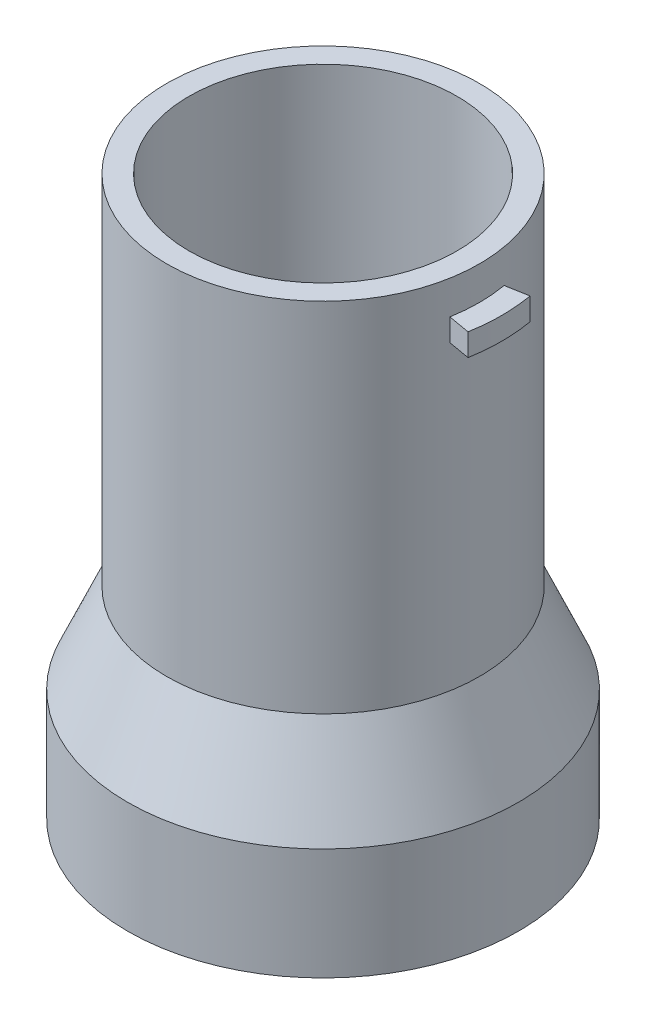
from build123d import *

# Parameters (mm, degrees)
SKETCH2_W          = 2
SKETCH2_H          = 2
REVOLVE2_ANGLE     = 20
SKETCH3_W          = 2.2
SKETCH3_H          = 6.8
CUT_REVOLVE1_ANGLE = 25
SKETCH4_W          = 4.7
SKETCH4_H          = 2.5
CUT_REVOLVE2_ANGLE = 45


with BuildPart() as part:
    # Sketch1 → Revolve1 (revolve)
    with BuildSketch(Plane.XY, mode=Mode.PRIVATE) as revolve1_sk:
        Polygon((12, 25), (12, -15), (14.5, -15), (14.5, -25), (17.5, -25), (17.5, -15), (14, -7), (14, 25), align=None)
    revolve(revolve1_sk.sketch.rotate(Axis((0, 40.467735012, 0), (0, -1, 0)), 90), axis=Axis((0, 40.467735012, 0), (0, -1, 0)))

    # Sketch2 → Revolve2 (revolve, symmetric)
    with BuildSketch(Plane.XY) as revolve2_sk:
        with Locations((15, 21)):
            Rectangle(SKETCH2_W, SKETCH2_H)
        with Locations((-15, 21)):
            Rectangle(SKETCH2_W, SKETCH2_H)
    revolve(axis=Axis((0, 45.306661743, 0), (0, -1, 0)), revolution_arc=REVOLVE2_ANGLE / 2)
    revolve(revolve2_sk.sketch, axis=Axis((0, 45.306661743, 0), (0, 1, 0)), revolution_arc=REVOLVE2_ANGLE / 2)

    # Sketch3 → Cut-Revolve1 (revolve, symmetric, cut)
    with BuildSketch(Plane.XY) as cut_revolve1_sk:
        with Locations((-15.6, -21.6)):
            Rectangle(SKETCH3_W, SKETCH3_H)
        with Locations((15.6, -21.6)):
            Rectangle(SKETCH3_W, SKETCH3_H)
    revolve(axis=Axis((0, -11.020729768, 0), (0, -1, 0)), revolution_arc=CUT_REVOLVE1_ANGLE / 2, mode=Mode.SUBTRACT)
    revolve(cut_revolve1_sk.sketch, axis=Axis((0, -11.020729768, 0), (0, 1, 0)), revolution_arc=CUT_REVOLVE1_ANGLE / 2, mode=Mode.SUBTRACT)

    # Sketch4 → Cut-Revolve2 (revolve, cut)
    with BuildSketch(Plane.XY):
        with Locations((-14.35, -19.45)):
            Rectangle(SKETCH4_W, SKETCH4_H)
        with Locations((14.35, -19.45)):
            Rectangle(SKETCH4_W, SKETCH4_H)
    revolve(axis=Axis((0, -42.004114959, 0), (0, 1, 0)), revolution_arc=CUT_REVOLVE2_ANGLE, mode=Mode.SUBTRACT)


solid = part.part
